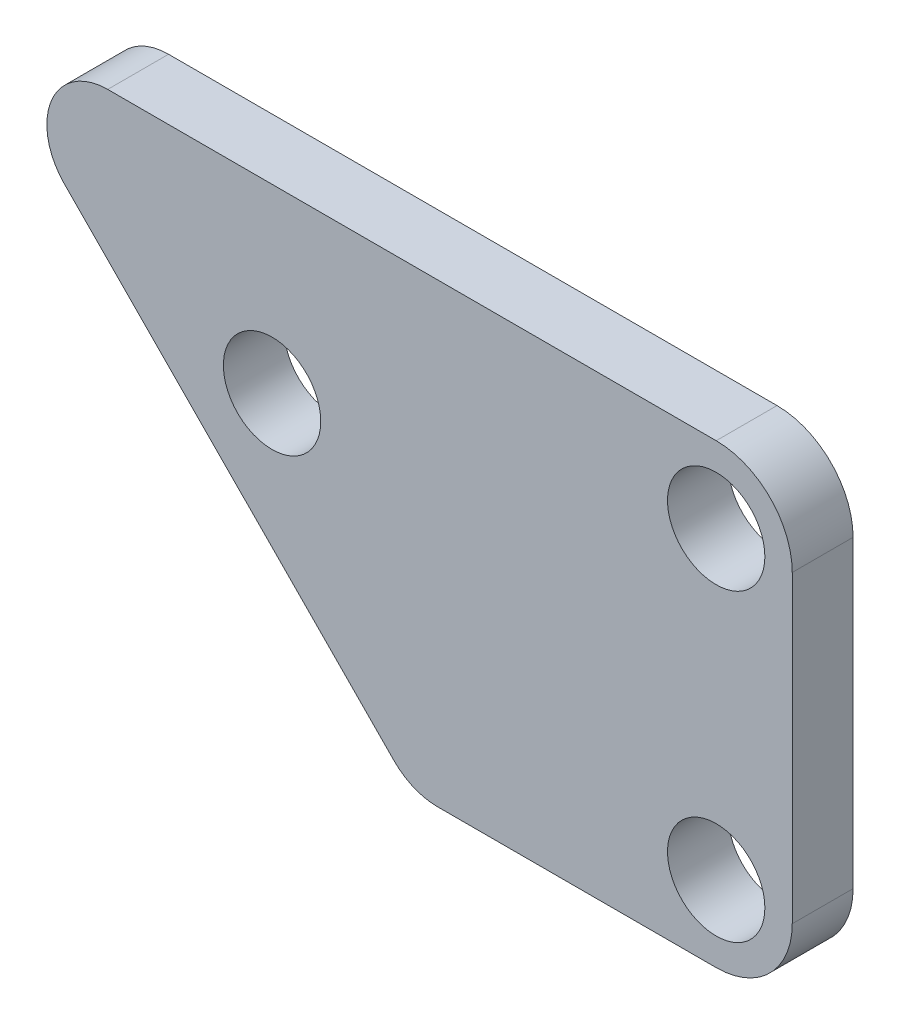
from build123d import *

# Parameters (mm, degrees)
SKETCH_1_R      = 1.6
EXTRUDE_1_DEPTH = 2


with BuildPart() as part:
    # ｽｹｯﾁ1 → ﾎﾞｽ - 押し出し1 (new body)
    with BuildSketch(Plane.XY):
        with BuildLine():
            Line((2.5, 0), (2.5, -10))
            ThreePointArc((2.5, -10), (1.767766953, -11.767766953), (0, -12.5))
            Line((0, -12.5), (-9.162823921, -12.5))
            ThreePointArc((-9.162823921, -12.5), (-9.93507402, -12.344892892), (-10.58754264, -11.903629784))
            Line((-10.58754264, -11.903629784), (-21.424718719, -0.903629784))
            ThreePointArc((-21.424718719, -0.903629784), (-21.844892892, 1.272250099), (-20, 2.5))
            Line((-20, 2.5), (0, 2.5))
            ThreePointArc((0, 2.5), (1.767766953, 1.767766953), (2.5, 0))
        make_face()
        Circle(SKETCH_1_R, mode=Mode.SUBTRACT)
        with Locations((0, -10)):
            Circle(SKETCH_1_R, mode=Mode.SUBTRACT)
        with Locations((-14.597859432, -3.45)):
            Circle(SKETCH_1_R, mode=Mode.SUBTRACT)
    extrude(amount=EXTRUDE_1_DEPTH)


solid = part.part
